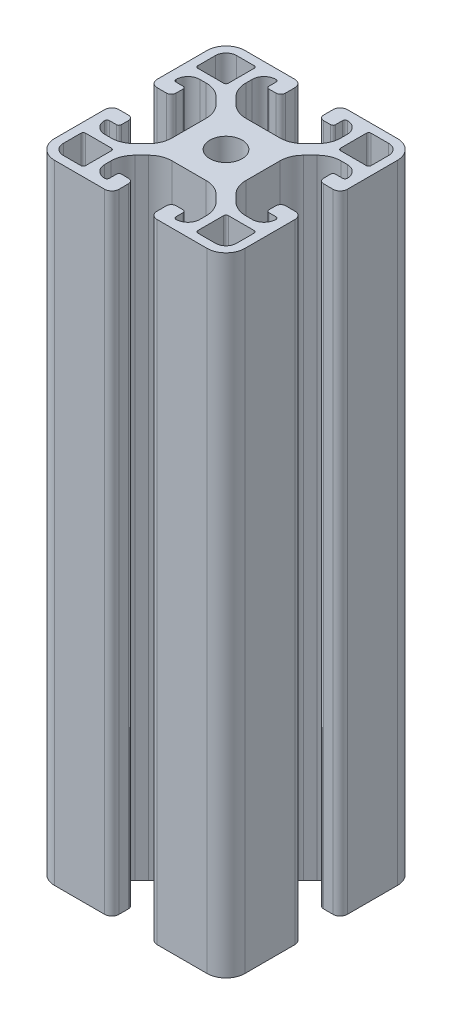
from build123d import *

# Parameters (mm, degrees)
SZKIC2_R                    = 3.4
DODANIE_WYCI_GNI_CIE2_DEPTH = 66


with BuildPart() as part:
    # Szkic2 → Dodanie-wyciągnięcie2 (new, symmetric)
    with BuildSketch(Plane(origin=(0, 0, 0), x_dir=(1, 0, 0), z_dir=(0, 1, 0))):
        with BuildLine():
            Line((-16, 20), (-5.499994708, 20))
            ThreePointArc((-5.499994708, 20), (-4.439334536, 19.560660172), (-3.999994708, 18.5))
            Line((-3.999994708, 18.5), (-3.999994708, 16.5))
            ThreePointArc((-3.999994708, 16.5), (-4.292887927, 15.792893219), (-4.999994708, 15.5))
            Line((-4.999994708, 15.5), (-6.499994708, 15.5))
            ThreePointArc((-6.499994708, 15.5), (-6.853548099, 15.646446609), (-6.999994708, 16))
            Line((-6.999994708, 16), (-6.999994708, 17.5))
            ThreePointArc((-6.999994708, 17.5), (-7.14644085, 17.853552923), (-7.499993385, 18))
            ThreePointArc((-7.499993385, 18), (-9.267764614, 17.267769292), (-10, 15.5))
            Line((-10, 15.5), (-10, 14.171067812))
            ThreePointArc((-10, 14.171067812), (-9.619397663, 12.25765065), (-8.535533906, 10.635533906))
            Line((-8.535533906, 10.635533906), (-7.114466094, 9.214466094))
            ThreePointArc((-7.114466094, 9.214466094), (-5.49234935, 8.130602337), (-3.578932188, 7.75))
            Line((-3.578932188, 7.75), (3.578932188, 7.75))
            ThreePointArc((3.578932188, 7.75), (5.49234935, 8.130602337), (7.114466094, 9.214466094))
            Line((7.114466094, 9.214466094), (8.535533906, 10.635533906))
            ThreePointArc((8.535533906, 10.635533906), (9.619397663, 12.25765065), (10, 14.171067812))
            Line((10, 14.171067812), (10, 15.5))
            ThreePointArc((10, 15.5), (9.267769292, 17.267764614), (7.500006615, 18))
            ThreePointArc((7.500006615, 18), (7.146452369, 17.853553858), (7.000005292, 17.5))
            Line((7.000005292, 17.5), (7.000005292, 16))
            ThreePointArc((7.000005292, 16), (6.853558682, 15.646446609), (6.500005292, 15.5))
            Line((6.500005292, 15.5), (5.000005292, 15.5))
            ThreePointArc((5.000005292, 15.5), (4.292898511, 15.792893219), (4.000005292, 16.5))
            Line((4.000005292, 16.5), (4.000005292, 18.5))
            ThreePointArc((4.000005292, 18.5), (4.43934512, 19.560660172), (5.500005292, 20))
            Line((5.500005292, 20), (16, 20))
            ThreePointArc((16, 20), (18.828427125, 18.828427125), (20, 16))
            Line((20, 16), (20, 5.499994708))
            ThreePointArc((20, 5.499994708), (19.560660172, 4.439334536), (18.5, 3.999994708))
            Line((18.5, 3.999994708), (16.5, 3.999994708))
            ThreePointArc((16.5, 3.999994708), (15.792893219, 4.292887927), (15.5, 4.999994708))
            Line((15.5, 4.999994708), (15.5, 6.499994708))
            ThreePointArc((15.5, 6.499994708), (15.646446609, 6.853548099), (16, 6.999994708))
            Line((16, 6.999994708), (17.5, 6.999994708))
            ThreePointArc((17.5, 6.999994708), (17.853552923, 7.14644085), (18, 7.499993385))
            ThreePointArc((18, 7.499993385), (17.267769292, 9.267764614), (15.5, 10))
            Line((15.5, 10), (14.171067812, 10))
            ThreePointArc((14.171067812, 10), (12.25765065, 9.619397663), (10.635533906, 8.535533906))
            Line((10.635533906, 8.535533906), (9.214466094, 7.114466094))
            ThreePointArc((9.214466094, 7.114466094), (8.130602337, 5.49234935), (7.75, 3.578932188))
            Line((7.75, 3.578932188), (7.75, -3.578932188))
            ThreePointArc((7.75, -3.578932188), (8.130602337, -5.49234935), (9.214466094, -7.114466094))
            Line((9.214466094, -7.114466094), (10.635533906, -8.535533906))
            ThreePointArc((10.635533906, -8.535533906), (12.25765065, -9.619397663), (14.171067812, -10))
            Line((14.171067812, -10), (15.5, -10))
            ThreePointArc((15.5, -10), (17.267764614, -9.267769292), (18, -7.500006615))
            ThreePointArc((18, -7.500006615), (17.853553858, -7.146452369), (17.5, -7.000005292))
            Line((17.5, -7.000005292), (16, -7.000005292))
            ThreePointArc((16, -7.000005292), (15.646446609, -6.853558682), (15.5, -6.500005292))
            Line((15.5, -6.500005292), (15.5, -5.000005292))
            ThreePointArc((15.5, -5.000005292), (15.792893219, -4.292898511), (16.5, -4.000005292))
            Line((16.5, -4.000005292), (18.5, -4.000005292))
            ThreePointArc((18.5, -4.000005292), (19.560660172, -4.43934512), (20, -5.500005292))
            Line((20, -5.500005292), (20, -16))
            ThreePointArc((20, -16), (18.828427125, -18.828427125), (16, -20))
            Line((16, -20), (5.499994708, -20))
            ThreePointArc((5.499994708, -20), (4.439334536, -19.560660172), (3.999994708, -18.5))
            Line((3.999994708, -18.5), (3.999994708, -16.5))
            ThreePointArc((3.999994708, -16.5), (4.292887927, -15.792893219), (4.999994708, -15.5))
            Line((4.999994708, -15.5), (6.499994708, -15.5))
            ThreePointArc((6.499994708, -15.5), (6.853548099, -15.646446609), (6.999994708, -16))
            Line((6.999994708, -16), (6.999994708, -17.5))
            ThreePointArc((6.999994708, -17.5), (7.14644085, -17.853552923), (7.499993385, -18))
            ThreePointArc((7.499993385, -18), (9.267764614, -17.267769292), (10, -15.5))
            Line((10, -15.5), (10, -14.171067812))
            ThreePointArc((10, -14.171067812), (9.619397663, -12.25765065), (8.535533906, -10.635533906))
            Line((8.535533906, -10.635533906), (7.114466094, -9.214466094))
            ThreePointArc((7.114466094, -9.214466094), (5.49234935, -8.130602337), (3.578932188, -7.75))
            Line((3.578932188, -7.75), (-3.578932188, -7.75))
            ThreePointArc((-3.578932188, -7.75), (-5.49234935, -8.130602337), (-7.114466094, -9.214466094))
            Line((-7.114466094, -9.214466094), (-8.535533906, -10.635533906))
            ThreePointArc((-8.535533906, -10.635533906), (-9.619397663, -12.25765065), (-10, -14.171067812))
            Line((-10, -14.171067812), (-10, -15.5))
            ThreePointArc((-10, -15.5), (-9.267769292, -17.267764614), (-7.500006615, -18))
            ThreePointArc((-7.500006615, -18), (-7.146452369, -17.853553858), (-7.000005292, -17.5))
            Line((-7.000005292, -17.5), (-7.000005292, -16))
            ThreePointArc((-7.000005292, -16), (-6.853558682, -15.646446609), (-6.500005292, -15.5))
            Line((-6.500005292, -15.5), (-5.000005292, -15.5))
            ThreePointArc((-5.000005292, -15.5), (-4.292898511, -15.792893219), (-4.000005292, -16.5))
            Line((-4.000005292, -16.5), (-4.000005292, -18.5))
            ThreePointArc((-4.000005292, -18.5), (-4.43934512, -19.560660172), (-5.500005292, -20))
            Line((-5.500005292, -20), (-16, -20))
            ThreePointArc((-16, -20), (-18.828427125, -18.828427125), (-20, -16))
            Line((-20, -16), (-20, -5.499994708))
            ThreePointArc((-20, -5.499994708), (-19.560660172, -4.439334536), (-18.5, -3.999994708))
            Line((-18.5, -3.999994708), (-16.5, -3.999994708))
            ThreePointArc((-16.5, -3.999994708), (-15.792893219, -4.292887927), (-15.5, -4.999994708))
            Line((-15.5, -4.999994708), (-15.5, -6.499994708))
            ThreePointArc((-15.5, -6.499994708), (-15.646446609, -6.853548099), (-16, -6.999994708))
            Line((-16, -6.999994708), (-17.5, -6.999994708))
            ThreePointArc((-17.5, -6.999994708), (-17.853552923, -7.14644085), (-18, -7.499993385))
            ThreePointArc((-18, -7.499993385), (-17.267769292, -9.267764614), (-15.5, -10))
            Line((-15.5, -10), (-14.171067812, -10))
            ThreePointArc((-14.171067812, -10), (-12.25765065, -9.619397663), (-10.635533906, -8.535533906))
            Line((-10.635533906, -8.535533906), (-9.214466094, -7.114466094))
            ThreePointArc((-9.214466094, -7.114466094), (-8.130602337, -5.49234935), (-7.75, -3.578932188))
            Line((-7.75, -3.578932188), (-7.75, 3.578932188))
            ThreePointArc((-7.75, 3.578932188), (-8.130602337, 5.49234935), (-9.214466094, 7.114466094))
            Line((-9.214466094, 7.114466094), (-10.635533906, 8.535533906))
            ThreePointArc((-10.635533906, 8.535533906), (-12.25765065, 9.619397663), (-14.171067812, 10))
            Line((-14.171067812, 10), (-15.5, 10))
            ThreePointArc((-15.5, 10), (-17.267764614, 9.267769292), (-18, 7.500006615))
            ThreePointArc((-18, 7.500006615), (-17.853553858, 7.146452369), (-17.5, 7.000005292))
            Line((-17.5, 7.000005292), (-16, 7.000005292))
            ThreePointArc((-16, 7.000005292), (-15.646446609, 6.853558682), (-15.5, 6.500005292))
            Line((-15.5, 6.500005292), (-15.5, 5.000005292))
            ThreePointArc((-15.5, 5.000005292), (-15.792893219, 4.292898511), (-16.5, 4.000005292))
            Line((-16.5, 4.000005292), (-18.5, 4.000005292))
            ThreePointArc((-18.5, 4.000005292), (-19.560660172, 4.43934512), (-20, 5.500005292))
            Line((-20, 5.500005292), (-20, 16))
            ThreePointArc((-20, 16), (-18.828427125, 18.828427125), (-16, 20))
        make_face()
        Circle(SZKIC2_R, mode=Mode.SUBTRACT)
        with BuildLine():
            Line((-11.8, -17.7), (-11.8, -12.3))
            ThreePointArc((-11.8, -12.3), (-11.946446609, -11.946446609), (-12.3, -11.8))
            Line((-12.3, -11.8), (-17.7, -11.8))
            ThreePointArc((-17.7, -11.8), (-18.053553391, -11.946446609), (-18.2, -12.3))
            Line((-18.2, -12.3), (-18.2, -16))
            ThreePointArc((-18.2, -16), (-17.555634919, -17.555634919), (-16, -18.2))
            Line((-16, -18.2), (-12.3, -18.2))
            ThreePointArc((-12.3, -18.2), (-11.946446609, -18.053553391), (-11.8, -17.7))
        make_face(mode=Mode.SUBTRACT)
        with BuildLine():
            Line((17.7, -11.8), (12.3, -11.8))
            ThreePointArc((12.3, -11.8), (11.946446609, -11.946446609), (11.8, -12.3))
            Line((11.8, -12.3), (11.8, -17.7))
            ThreePointArc((11.8, -17.7), (11.946446609, -18.053553391), (12.3, -18.2))
            Line((12.3, -18.2), (16, -18.2))
            ThreePointArc((16, -18.2), (17.555634919, -17.555634919), (18.2, -16))
            Line((18.2, -16), (18.2, -12.3))
            ThreePointArc((18.2, -12.3), (18.053553391, -11.946446609), (17.7, -11.8))
        make_face(mode=Mode.SUBTRACT)
        with BuildLine():
            Line((11.8, 17.7), (11.8, 12.3))
            ThreePointArc((11.8, 12.3), (11.946446609, 11.946446609), (12.3, 11.8))
            Line((12.3, 11.8), (17.7, 11.8))
            ThreePointArc((17.7, 11.8), (18.053553391, 11.946446609), (18.2, 12.3))
            Line((18.2, 12.3), (18.2, 16))
            ThreePointArc((18.2, 16), (17.555634919, 17.555634919), (16, 18.2))
            Line((16, 18.2), (12.3, 18.2))
            ThreePointArc((12.3, 18.2), (11.946446609, 18.053553391), (11.8, 17.7))
        make_face(mode=Mode.SUBTRACT)
        with BuildLine():
            Line((-11.8, 12.3), (-11.8, 17.7))
            ThreePointArc((-11.8, 17.7), (-11.946446609, 18.053553391), (-12.3, 18.2))
            Line((-12.3, 18.2), (-16, 18.2))
            ThreePointArc((-16, 18.2), (-17.555634919, 17.555634919), (-18.2, 16))
            Line((-18.2, 16), (-18.2, 12.3))
            ThreePointArc((-18.2, 12.3), (-18.053553391, 11.946446609), (-17.7, 11.8))
            Line((-17.7, 11.8), (-12.3, 11.8))
            ThreePointArc((-12.3, 11.8), (-11.946446609, 11.946446609), (-11.8, 12.3))
        make_face(mode=Mode.SUBTRACT)
    extrude(amount=DODANIE_WYCI_GNI_CIE2_DEPTH, both=True)


solid = part.part
